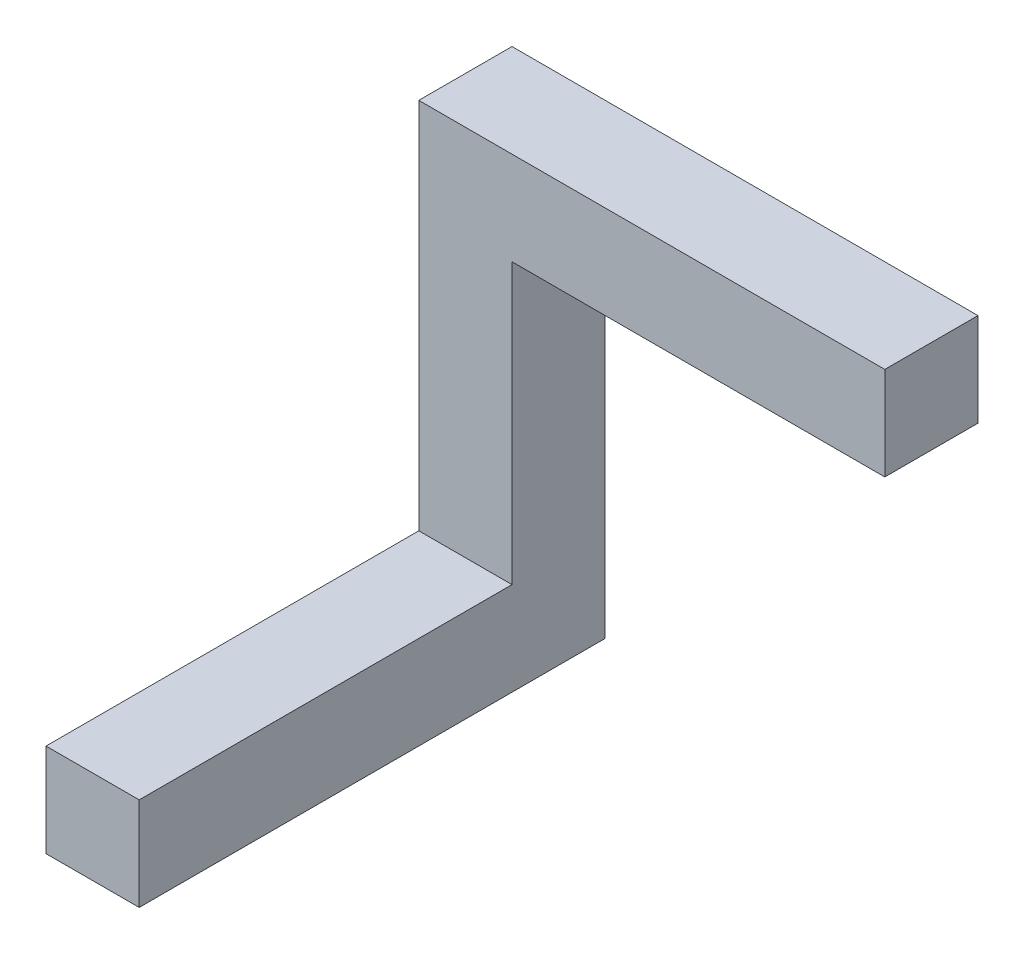
from build123d import *

# Parameters (mm, degrees)
SALIENTE_EXTRUIR1_DEPTH = 30
CROQUIS2_W              = 30
CROQUIS2_H              = 30
SALIENTE_EXTRUIR3_DEPTH = 150


with BuildPart() as part:
    # Croquis1 → Saliente-Extruir1 (new body)
    with BuildSketch(Plane.XY):
        Polygon((-130, 135), (-130, -15), (-100, -15), (-100, 105), (20, 105), (20, 135), align=None)
    extrude(amount=SALIENTE_EXTRUIR1_DEPTH)

    # Croquis2 → Saliente-Extruir3 (add)
    with BuildSketch(Plane.XY):
        with Locations((-115, 0)):
            Rectangle(CROQUIS2_W, CROQUIS2_H)
    extrude(amount=SALIENTE_EXTRUIR3_DEPTH)


solid = part.part
